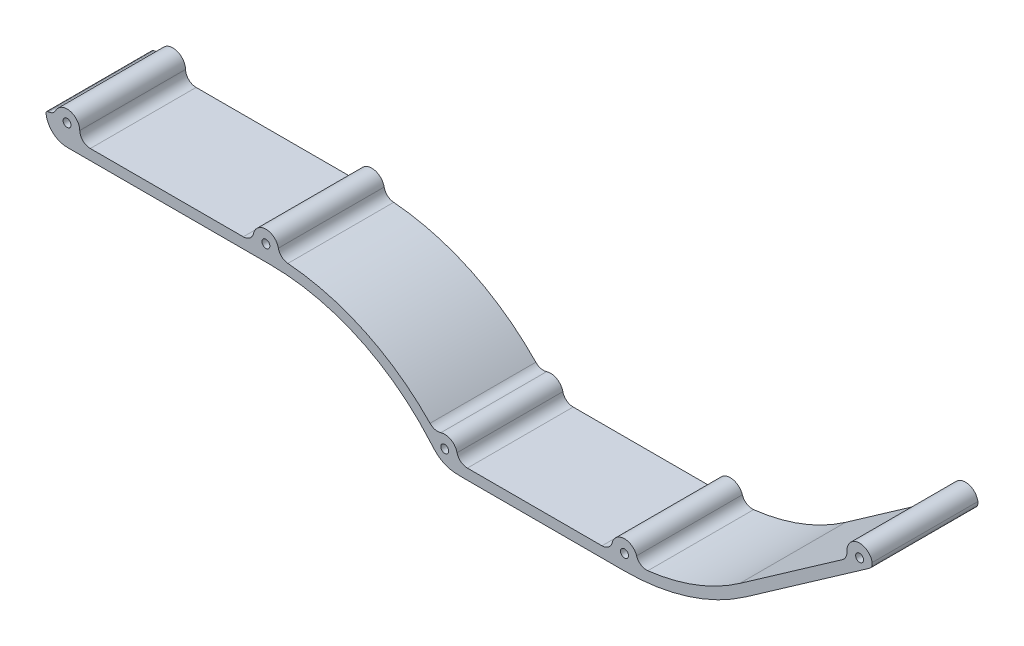
from build123d import *

# Parameters (mm, degrees)
SKETCH1_R           = 1.8749999999999902
SKETCH1_R_2         = 1.8749999999999822
BOSS_EXTRUDE1_DEPTH = 50


with BuildPart() as part:
    # Sketch1 → Boss-Extrude1 (new body)
    # profile 1 of 3: a face of its own
    with BuildSketch(Plane.XY):
        with BuildLine():
            ThreePointArc((-544.9073445733862, 245.05934298496234), (-541.6610147269474, 238.65452406819674), (-534.9592100975257, 236.0765059267749))
            Line((-534.9592100975257, 236.07650592677487), (-441.5899759130262, 236.07650592677487))
            Line((-441.5899759130262, 236.07650592677484), (-439.06259783112466, 236.07650592677484))
            ThreePointArc((-439.06259783112466, 236.07650592677484), (-397.37358262088145, 226.97219345264216), (-363.27556383489673, 201.31702614277702))
            add(Edge.make_bspline(
                [(-383.12296849125244, 224.93458304595043), (-367.62274464990907, 206.36695430282649), (-363.27556383489645, 201.31702614277665)],
                knots=[-0.5220285895473142, -0.5220285895473142, -0.5220285895473142, 1.887e-14, 1.887e-14, 1.887e-14], degree=2))
            ThreePointArc((-383.1229684912514, 224.93458304595174), (-405.8980891559586, 235.70137914794805), (-430.5822522506289, 240.7334872459175))
            ThreePointArc((-430.5822522506289, 240.7334872459175), (-433.50085290752264, 241.98064646711703), (-435.0806969123075, 244.73341395420863))
            ThreePointArc((-435.08069691230753, 244.73341395420863), (-440.8631120126931, 249.55208851055136), (-446.8033920996223, 244.92942462898426))
            ThreePointArc((-446.8033920996222, 244.92942462898426), (-448.5664399466794, 242.15633970013647), (-451.6700341140156, 241.07650592677487))
            Line((-451.6700341140156, 241.07650592677487), (-523.9636485779045, 241.07650592677487))
            ThreePointArc((-523.9636485779045, 241.07650592677481), (-527.448607657875, 242.49111052167248), (-528.9616310868231, 245.93448184240285))
            ThreePointArc((-528.9616310868231, 245.93448184240285), (-533.6831252946306, 251.62678332689148), (-540.3433752762132, 248.41183792649997))
            ThreePointArc((-540.3433752762132, 248.41183792649997), (-541.6780229849218, 246.8731065868591), (-543.5973644050546, 246.19111893673872))
            Line((-543.5973644050546, 246.19111893673875), (-543.9963947067045, 246.15753652414114))
            ThreePointArc((-543.9963947067045, 246.15753652414116), (-544.6822020264595, 245.79950011796763), (-544.9073445733864, 245.05934298496234))
        make_face()
        with Locations((-534.9592100975258, 246.07650592677487)):
            Circle(SKETCH1_R, mode=Mode.SUBTRACT)
        with Locations((-440.9634216823502, 243.55292707163554)):
            Circle(SKETCH1_R, mode=Mode.SUBTRACT)
    # profile 2 of 3: a face of its own
    with BuildSketch(Plane.XY):
        with BuildLine():
            add(Edge.make_bspline(
                [(-383.12296849125244, 224.93458304595043), (-367.62274464990907, 206.36695430282649), (-363.27556383489645, 201.31702614277665)],
                knots=[-0.5220285895473142, -0.5220285895473142, -0.5220285895473142, 1.887e-14, 1.887e-14, 1.887e-14], degree=2))
            add(Edge.make_bspline(
                [(-363.2755638348965, 201.3170261427767), (-362.2346292716234, 200.10781838548988), (-361.83317155831753, 199.67366875065946), (-361.04162411691453, 198.81766319578747), (-360.27634316412167, 198.13844219041232), (-358.52376862577097, 196.58295405812672), (-356.6619331821235, 195.7294886371459), (-354.80036900749667, 194.8761475658919), (-352.4846532551344, 194.56947395223122), (-351.48825008923626, 194.4375188281029), (-350.30526494816087, 194.39325502601127), (-349.5536063403822, 194.3651301859774), (-348.11815703565105, 194.36513018597736)],
                knots=[1.893e-14, 1.893e-14, 1.893e-14, 0.125, 0.125, 0.25, 0.25, 0.5, 0.5, 0.75, 0.75, 0.875, 0.875, 1.0000000000000016, 1.0000000000000016, 1.0000000000000016], degree=2))
            add(Edge.make_bspline(
                [(-348.11815703565105, 194.36513018597736), (-333.4550041742609, 194.36513018597725), (-247.44050149953085, 197.29986636862012)],
                knots=[1.0000000000000016, 1.0000000000000016, 1.0000000000000016, 2.276878327665547, 2.276878327665547, 2.276878327665547], degree=2))
            ThreePointArc((-247.44050149953077, 197.29986636861926), (-230.0871000090499, 203.33834671649424), (-214.13144535031904, 212.4499257570787))
            Line((-214.13144535031904, 212.44992575707866), (-155.67654819642465, 253.3804853895092))
            ThreePointArc((-155.67654819642465, 253.3804853895092), (-154.62961317001395, 254.68034309191702), (-154.43933268041653, 256.3385036183176))
            ThreePointArc((-154.4393326804165, 256.3385036183176), (-161.0507101720321, 261.2969344989494), (-166.3426632069391, 254.94936943737002))
            ThreePointArc((-166.34266320693914, 254.94936943737002), (-166.8247741855496, 252.4619720660458), (-168.46431508885058, 250.5302675583712))
            Line((-168.46431508885058, 250.5302675583712), (-216.9993275320743, 216.5456859785236))
            ThreePointArc((-216.9993275320743, 216.5456859785236), (-237.69631255795534, 205.57859820435817), (-260.44760709280405, 200.00896622402453))
            ThreePointArc((-260.44760709280405, 200.0089662240245), (-263.72642255227106, 200.76527055587718), (-265.7834428399557, 203.42821903372513))
            ThreePointArc((-265.7834428399557, 203.42821903372513), (-271.6624634978908, 207.56948031752756), (-277.29243682695915, 203.0955190714807))
            ThreePointArc((-277.29243682695915, 203.0955190714807), (-279.07471454855846, 200.40608638901813), (-282.12856002823787, 199.36513018597742))
            Line((-282.12856002823787, 199.3651301859774), (-345.74927319295944, 199.3651301859774))
            ThreePointArc((-345.74927319295944, 199.36513018597742), (-348.8572930869804, 200.4484718732866), (-350.61849397452966, 203.22904525062938))
            ThreePointArc((-350.61849397452966, 203.22904525062938), (-353.49762862356397, 207.08255435055457), (-358.2818252430184, 207.58296559830646))
            ThreePointArc((-358.2818252430184, 207.5829655983065), (-361.0270213713086, 207.50053911285607), (-363.40161766909495, 208.88046241899406))
            ThreePointArc((-363.40161766909495, 208.88046241899406), (-372.7744857551701, 217.50675950249254), (-383.1229684912514, 224.93458304595174))
        make_face()
        with Locations((-356.46155891241386, 201.86574332821175)):
            Circle(SKETCH1_R, mode=Mode.SUBTRACT)
        with Locations((-271.4890889854247, 201.57198573408468)):
            Circle(SKETCH1_R, mode=Mode.SUBTRACT)
        with Locations((-160.35522233053905, 255.3373794264347)):
            Circle(SKETCH1_R_2, mode=Mode.SUBTRACT)
    # profile 3 of 3: a face of its own
    with BuildSketch(Plane.XY):
        with BuildLine():
            add(Edge.make_bspline(
                [(-348.11815703565105, 194.36513018597736), (-333.4550041742609, 194.36513018597725), (-247.44050149953085, 197.29986636862012)],
                knots=[1.0000000000000016, 1.0000000000000016, 1.0000000000000016, 2.276878327665547, 2.276878327665547, 2.276878327665547], degree=2))
            Line((-348.11815703565105, 194.3651301859774), (-271.4890889854247, 194.36513018597734))
            ThreePointArc((-271.4890889854247, 194.36513018597736), (-259.3755920034587, 195.10152562283494), (-247.44050149953077, 197.29986636861926))
        make_face()
    extrude(amount=BOSS_EXTRUDE1_DEPTH)


solid = part.part
